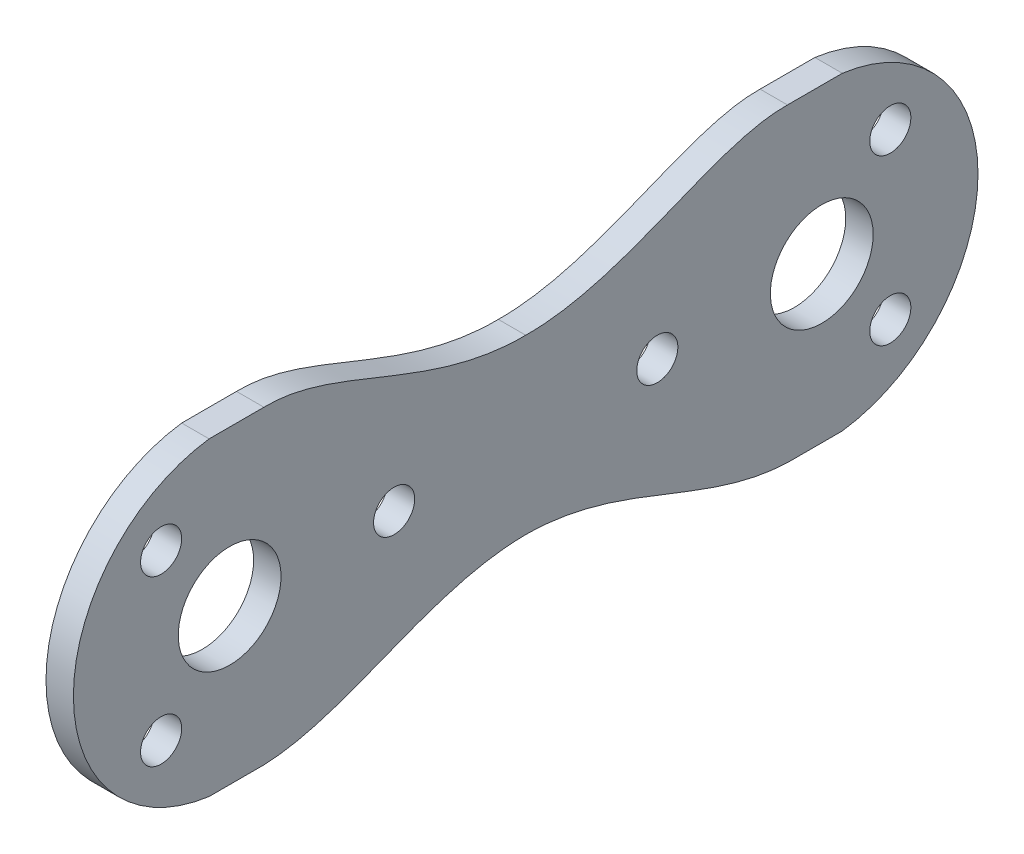
from build123d import *

# Parameters (mm, degrees)
SCHIZZO1_R                   = 1.5
SCHIZZO1_R_2                 = 3.75
ESTRUSIONE_ESTRUSIONE1_DEPTH = 2


with BuildPart() as part:
    # Schizzo1 → Estrusione-Estrusione1 (new body)
    with BuildSketch(Plane(origin=(0, 0, 0), x_dir=(0, 0, -1), z_dir=(1, 0, 0))):
        with BuildLine():
            Line((-2.501010101, -11.3), (1.498989899, -11.3))
            ThreePointArc((1.498989899, -11.3), (11.398989899, 0), (1.498989899, 11.3))
            Line((1.498989899, 11.3), (-2.501010101, 11.3))
            add(Edge.make_bspline(
                [(-2.501010101, 11.3), (-7.839898951, 11.429610053), (-14.35178918, 6.216652626), (-21.601010101, 6.3)],
                knots=[0, 0, 0, 0, 1, 1, 1, 1], degree=3))
            add(Edge.make_bspline(
                [(-40.701010101, 11.3), (-35.362121251, 11.429610053), (-28.850231022, 6.216652626), (-21.601010101, 6.3)],
                knots=[0, 0, 0, 0, 1, 1, 1, 1], degree=3))
            Line((-40.701010101, 11.3), (-44.701010101, 11.3))
            ThreePointArc((-44.701010101, 11.3), (-54.601010101, 0), (-44.701010101, -11.3))
            Line((-44.701010101, -11.3), (-40.701010101, -11.3))
            add(Edge.make_bspline(
                [(-40.701010101, -11.3), (-34.455779635, -11.063584615), (-28.769360616, -6.33994929), (-21.601010101, -6.3)],
                knots=[0, 0, 0, 0, 1, 1, 1, 1], degree=3))
            add(Edge.make_bspline(
                [(-2.501010101, -11.3), (-8.746240567, -11.063584615), (-14.432659586, -6.33994929), (-21.601010101, -6.3)],
                knots=[0, 0, 0, 0, 1, 1, 1, 1], degree=3))
        make_face()
        with Locations((-48.202020202, 6)):
            Circle(SCHIZZO1_R, mode=Mode.SUBTRACT)
        with Locations((-48.202020202, -6)):
            Circle(SCHIZZO1_R, mode=Mode.SUBTRACT)
        with Locations((-31.202020202, 0)):
            Circle(SCHIZZO1_R, mode=Mode.SUBTRACT)
        with Locations((-12, 0)):
            Circle(SCHIZZO1_R, mode=Mode.SUBTRACT)
        with Locations((5, 6)):
            Circle(SCHIZZO1_R, mode=Mode.SUBTRACT)
        with Locations((5, -6)):
            Circle(SCHIZZO1_R, mode=Mode.SUBTRACT)
        with Locations((-43.202020202, 0)):
            Circle(SCHIZZO1_R_2, mode=Mode.SUBTRACT)
        Circle(SCHIZZO1_R_2, mode=Mode.SUBTRACT)
    extrude(amount=ESTRUSIONE_ESTRUSIONE1_DEPTH)


solid = part.part
